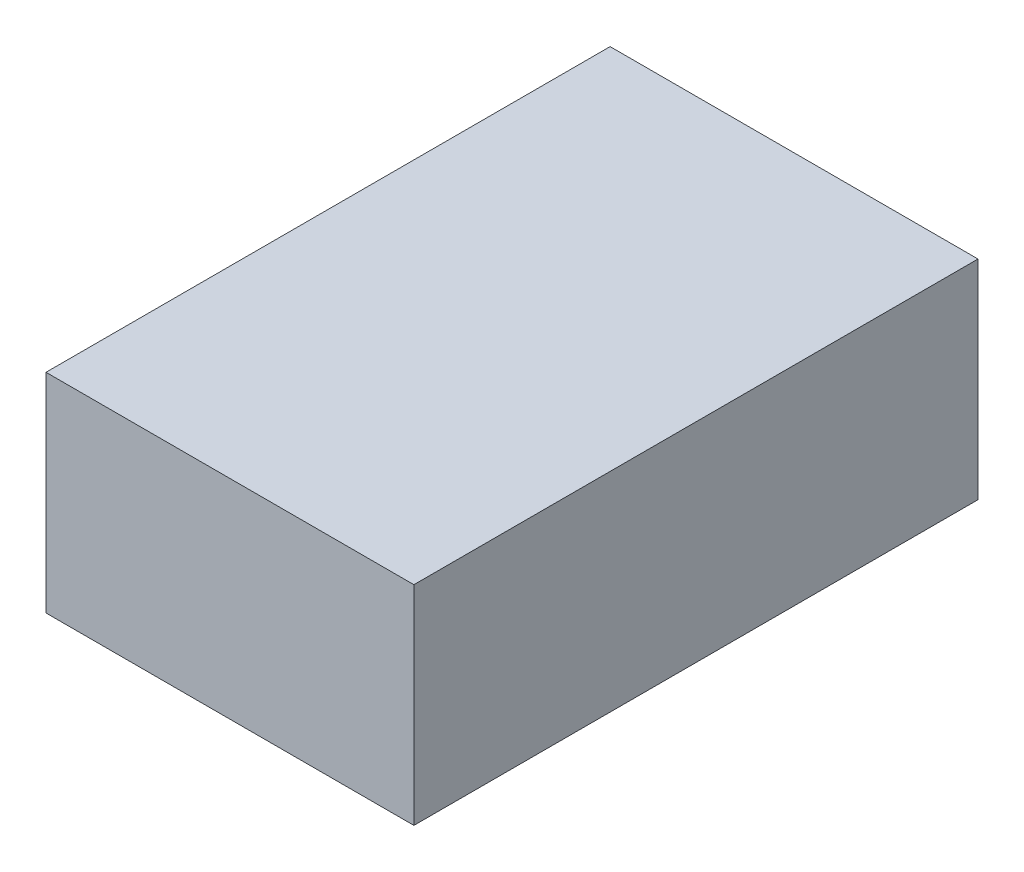
from build123d import *

# Parameters (mm, degrees)
SKETCH1_W         = 300
SKETCH1_H         = 460
ACCUMULATOR_DEPTH = 170


with BuildPart() as part:
    # Sketch1 → Accumulator (new body)
    with BuildSketch(Plane(origin=(0, 0, 0), x_dir=(1, 0, 0), z_dir=(0, 1, 0))):
        with Locations((-1382.253521127, 1201.830985915)):
            Rectangle(SKETCH1_W, SKETCH1_H)
    extrude(amount=ACCUMULATOR_DEPTH)


solid = part.part
